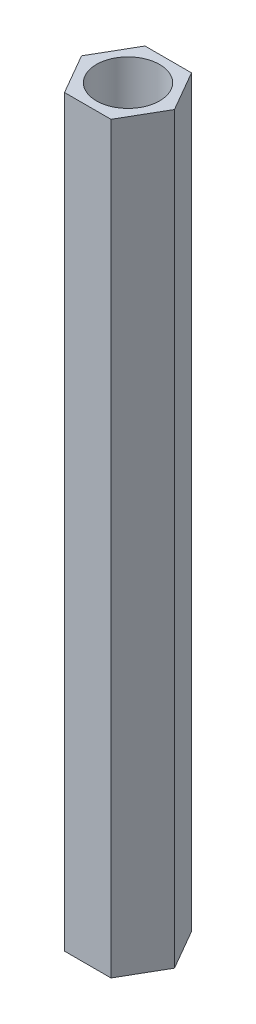
from build123d import *

# Parameters (mm, degrees)
BOSS_EXTRUDE1_DEPTH = 40
SKETCH30_R          = 1.7
CUT_EXTRUDE1_DEPTH  = 44


with BuildPart() as part:
    # Sketch1 → Boss-Extrude1 (new body)
    with BuildSketch(Plane(origin=(0, 0, 0), x_dir=(1, 0, 0), z_dir=(0, 1, 0))):
        Polygon((2.5, 0), (1.25, 2.165063509), (-1.25, 2.165063509), (-2.5, 0), (-1.25, -2.165063509), (1.25, -2.165063509), align=None)
    extrude(amount=BOSS_EXTRUDE1_DEPTH)

    # Sketch30 → Cut-Extrude1 (cut)
    with BuildSketch(Plane(origin=(0, 40, 0), x_dir=(1, 0, 0), z_dir=(0, 1, 0))):
        with Locations(Location((0, 0, 0), (0, 0, 270))):
            Circle(SKETCH30_R)
    extrude(amount=-CUT_EXTRUDE1_DEPTH, mode=Mode.SUBTRACT)


solid = part.part
